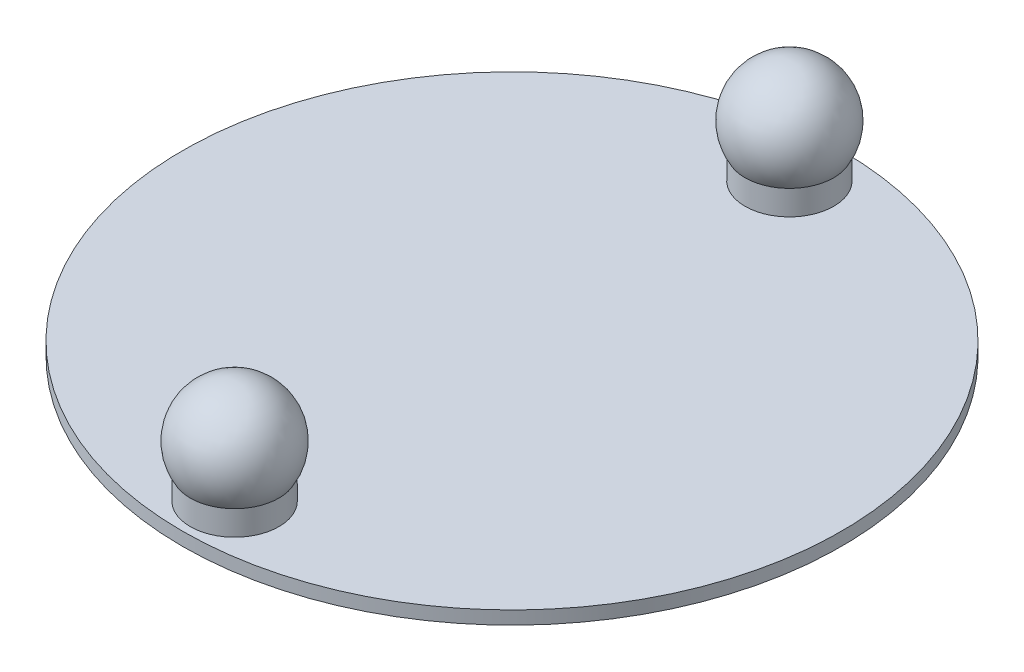
from build123d import *

# Parameters (mm, degrees)
SKETCH1_R = 20
PCB_DEPTH = 0.8


with BuildPart() as part:
    # Sketch1 → PCB (new body)
    with BuildSketch(Plane(origin=(0, 0, 0), x_dir=(1, 0, 0), z_dir=(0, 1, 0))):
        with Locations(Location((0, 0, 0), (0, 0, 270))):
            Circle(SKETCH1_R)
    extrude(amount=PCB_DEPTH)

    # Sketch3 → Revolve1 (revolve)
    with BuildSketch(Plane(origin=(0, 0, 0), x_dir=(0, 0, -1), z_dir=(1, 0, 0)), mode=Mode.PRIVATE) as revolve1_sk:
        with BuildLine():
            Line((-16.835, 7.13), (-16.835, 0.8))
            Line((-16.835, 0.8), (-19.526653767, 0.8))
            Line((-19.526653767, 0.8), (-19.526653767, 2.3))
            ThreePointArc((-19.526653767, 2.3), (-19.599683526, 5.505697894), (-16.835, 7.13))
        make_face()
    revolve1 = revolve(revolve1_sk.sketch.rotate(Axis((0, 7.13, 16.835), (0, -1, 0)), 180), axis=Axis((0, 7.13, 16.835), (0, -1, 0)))

    # Mirror1: Revolve1 across plane
    add(revolve1.mirror(Plane.XY))


solid = part.part
